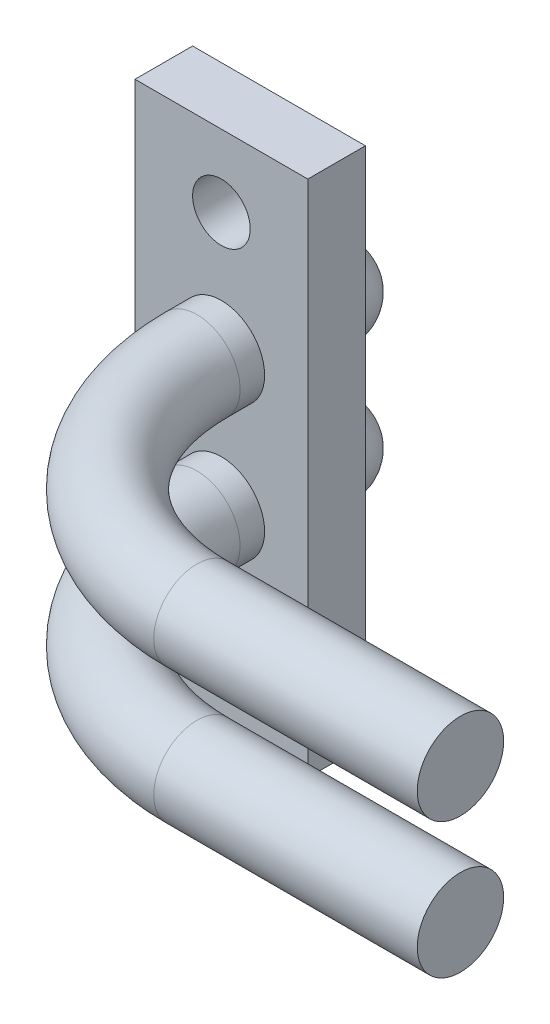
from build123d import *

# Parameters (mm, degrees)
SKETCH1_W           = 6
SKETCH1_H           = 18
BOSS_EXTRUDE1_DEPTH = 2
SKETCH2_R           = 1.5
BOSS_EXTRUDE2_DEPTH = 3
FILLET1_R           = 1.5
SKETCH3_R           = 1.5
SKETCH5_R           = 1
CUT_EXTRUDE1_DEPTH  = 22.33647117


with BuildPart() as part:
    # Sketch1 → Boss-Extrude1 (new body)
    with BuildSketch(Plane.XY):
        Rectangle(SKETCH1_W, SKETCH1_H)
    extrude(amount=BOSS_EXTRUDE1_DEPTH)

    # Sketch2 → Boss-Extrude2 (add)
    with BuildSketch(Plane(origin=(0, 0, 0), x_dir=(-1, 0, 0), z_dir=(0, 0, -1))):
        with Locations((0, 2.35)):
            Circle(SKETCH2_R)
        with Locations((0, -2.35)):
            Circle(SKETCH2_R)
    extrude(amount=BOSS_EXTRUDE2_DEPTH)

    # Fillet1
    fillet1_edges = [part.edges().sort_by_distance(p)[0] for p in [
        (1.5, 2.35, -3),
        (1.5, -2.35, -3),
    ]]
    fillet(fillet1_edges, radius=FILLET1_R)

    # Sweep1: sweep along a path in Sketch4
    with BuildLine(Plane(origin=(0, 2.35, 0), x_dir=(-1, 0, 0), z_dir=(0, 1, 0))) as sweep1_path:
        Line((0, 2), (0, 2.85))
        ThreePointArc((0, 2.85), (-2.196699141, 8.153300859), (-7.5, 10.35))
        Line((-7.5, 10.35), (-16.65, 10.35))
    # Sketch3 → Sweep1 (sweep)
    with BuildSketch(Plane.XY.offset(2)):
        with Locations((0, -2.35)):
            Circle(SKETCH3_R)
        with Locations((0, 2.35)):
            Circle(SKETCH3_R)
    sweep(path=sweep1_path.line)

    # Sketch5 → Cut-Extrude1 (cut, through all)
    with BuildSketch(Plane.XY.offset(2)):
        with Locations((0, 6.5)):
            Circle(SKETCH5_R)
        with Locations(Location((0, -6.5, 0), (0, 0, 180))):
            Circle(SKETCH5_R)
    extrude(amount=-CUT_EXTRUDE1_DEPTH, mode=Mode.SUBTRACT)


solid = part.part
